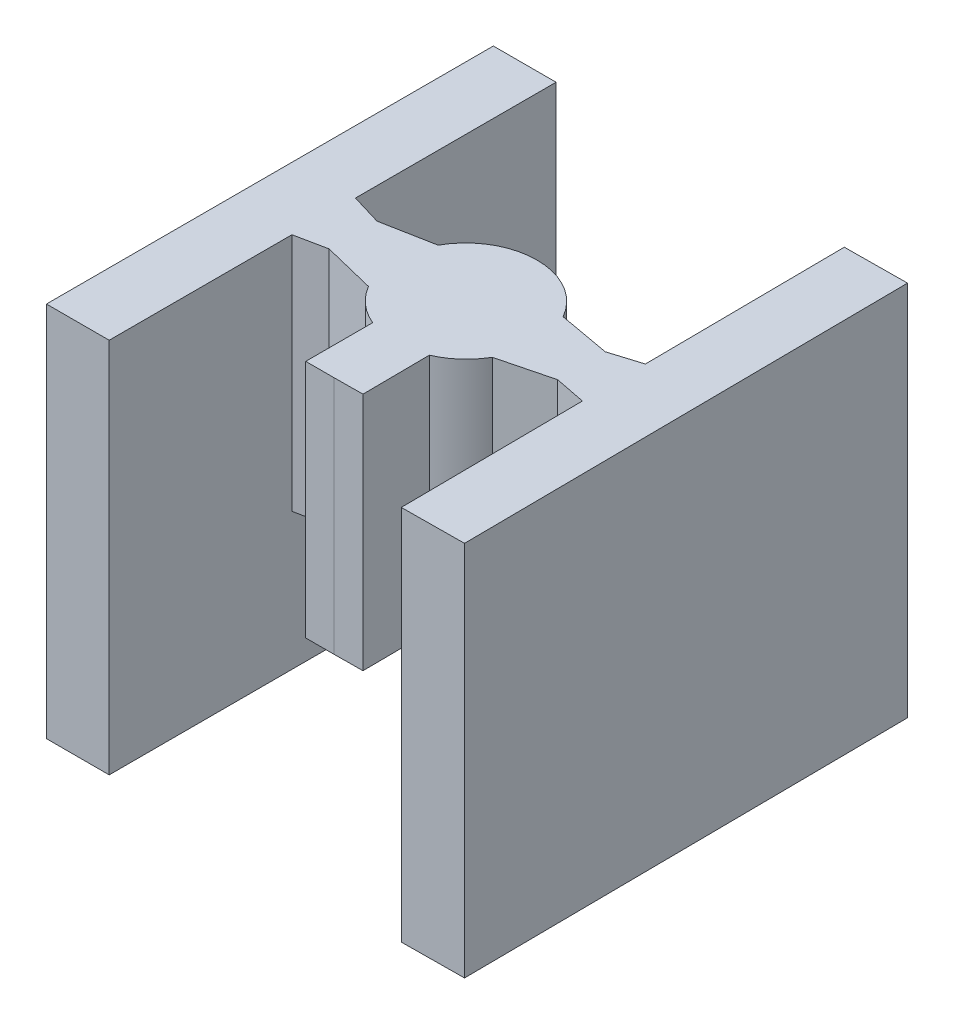
from build123d import *

# Parameters (mm, degrees)
BOSS_EXTRUDE1_DEPTH     = 33
CUT_EXTRUDE1_DEPTH      = 83.954293528
CUT_EXTRUDE1_DEPTH_BACK = 12
SKETCH3_W               = 9.481209811
SKETCH3_H               = 17.021727652
CUT_EXTRUDE2_DEPTH      = 22


with BuildPart() as part:
    # Sketch1 → Boss-Extrude1 (new body)
    with BuildSketch(Plane(origin=(0, 0, 0), x_dir=(1, 0, 0), z_dir=(0, 1, 0))):
        with BuildLine():
            Line((27.99701897, 26.104397373), (30.497019389, 26.104397373))
            Line((30.497019389, 26.104397373), (32.996926828, 26.125958592))
            Line((32.996926828, 26.125958592), (32.946330796, 31.992296402))
            ThreePointArc((32.946330796, 31.992296402), (34.614300355, 33.056919945), (35.86386473, 34.591238885))
            Line((35.86386473, 34.591238885), (40.431539769, 35.753760832))
            Line((40.431539769, 35.753760832), (43.136211097, 35.223788843))
            Line((43.136211097, 35.223788843), (43.274382132, 19.203600277))
            Line((43.274382132, 19.203600277), (48.774177579, 19.251034952))
            Line((48.774177579, 19.251034952), (48.43630867, 58.425118026))
            Line((48.43630867, 58.425118026), (42.936513223, 58.377683351))
            Line((42.936513223, 58.377683351), (43.088196039, 40.790876563))
            Line((43.088196039, 40.790876563), (40.395268448, 39.959225491))
            Line((40.395268448, 39.959225491), (35.888631414, 40.775372904))
            ThreePointArc((35.888631414, 40.775372904), (33.583892359, 43.097075019), (30.420151943, 43.929462788))
            ThreePointArc((30.420151943, 43.929462788), (27.263708108, 43.06982034), (24.979078258, 40.728327384))
            Line((24.979078258, 40.728327384), (20.479647685, 39.873342894))
            Line((20.479647685, 39.873342894), (17.779647685, 40.681737919))
            Line((17.779647685, 40.681737919), (17.779647685, 58.269198812))
            Line((17.779647685, 58.269198812), (12.279647685, 58.269198812))
            Line((12.279647685, 58.269198812), (12.279647685, 19.093658738))
            Line((12.279647685, 19.093658738), (17.779647685, 19.093658738))
            Line((17.779647685, 19.093658738), (17.779647685, 35.114443143))
            Line((17.779647685, 35.114443143), (20.479647685, 35.667721822))
            Line((20.479647685, 35.667721822), (25.057179, 34.544636961))
            ThreePointArc((25.057179, 34.544636961), (26.319929615, 33.021151936), (27.99701897, 31.970953369))
            Line((27.99701897, 31.970953369), (27.99701897, 26.104397373))
        make_face()
    extrude(amount=BOSS_EXTRUDE1_DEPTH)

    # Sketch2 → Cut-Extrude1 (cut, two sides: drawn at the far end of the back side and taken through both)
    with BuildSketch(Plane.XZ.offset(-CUT_EXTRUDE1_DEPTH_BACK)):
        with BuildLine():
            Line((20.479647685, -35.667721822), (17.779647685, -35.114443143))
            Line((17.779647685, -35.114443143), (17.779647685, -40.681737919))
            Line((17.779647685, -40.681737919), (20.479647685, -39.873342894))
            Line((20.479647685, -39.873342894), (24.979078258, -40.728327384))
            ThreePointArc((24.979078258, -40.728327384), (27.263708108, -43.06982034), (30.420151943, -43.929462788))
            ThreePointArc((30.420151943, -43.929462788), (33.576595778, -43.084424394), (35.888631414, -40.775372904))
            Line((35.888631414, -40.775372904), (40.395268448, -39.959225491))
            Line((40.395268448, -39.959225491), (43.088196039, -40.790876563))
            Line((43.088196039, -40.790876563), (43.136211097, -35.223788843))
            Line((43.136211097, -35.223788843), (40.431539769, -35.753760832))
            Line((40.431539769, -35.753760832), (35.86386473, -34.591238885))
            ThreePointArc((35.86386473, -34.591238885), (34.614300355, -33.056919945), (32.946330796, -31.992296402))
            Line((32.946330796, -31.992296402), (32.996926828, -26.125958592))
            Line((32.996926828, -26.125958592), (27.99701897, -26.104397373))
            Line((27.99701897, -26.104397373), (27.99701897, -31.970953369))
            ThreePointArc((27.99701897, -31.970953369), (26.319929615, -33.021151936), (25.057179, -34.544636961))
            Line((25.057179, -34.544636961), (20.479647685, -35.667721822))
        make_face()
    extrude(amount=CUT_EXTRUDE1_DEPTH + CUT_EXTRUDE1_DEPTH_BACK, mode=Mode.SUBTRACT)

    # Sketch3 → Cut-Extrude2 (cut)
    with BuildSketch(Plane.XY.offset(-26.104397373)):
        with Locations((32.737623876, 3.489136174)):
            Rectangle(SKETCH3_W, SKETCH3_H)
    extrude(amount=-CUT_EXTRUDE2_DEPTH, mode=Mode.SUBTRACT)


solid = part.part
